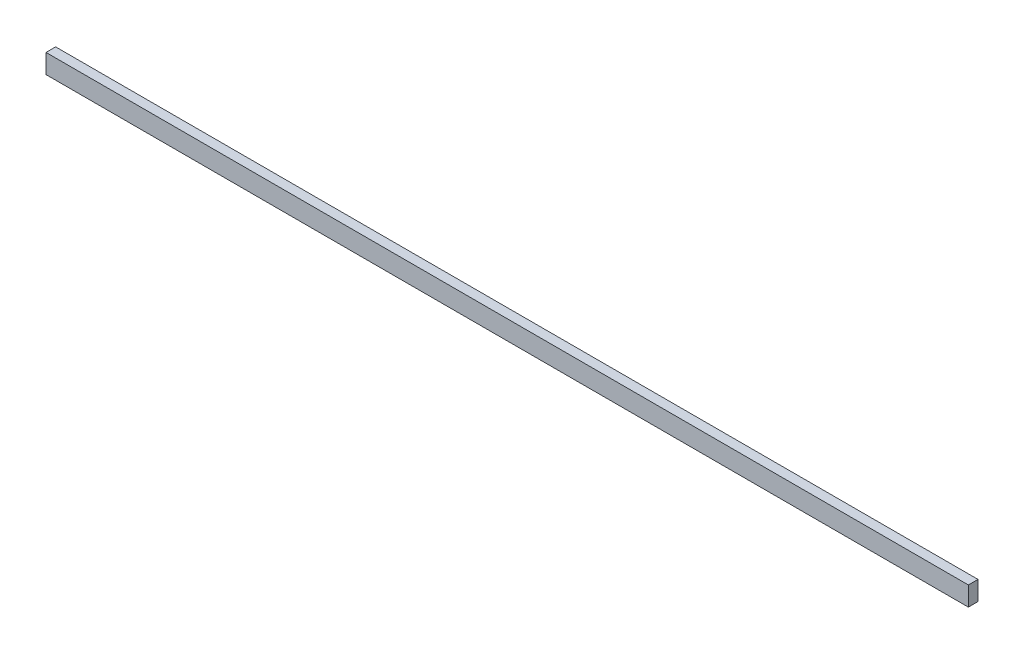
from build123d import *

# Parameters (mm, degrees)
SKETCH2_W           = 457.2
SKETCH2_H           = 4.7752
BOSS_EXTRUDE1_DEPTH = 9.525


with BuildPart() as part:
    # Sketch2 → Boss-Extrude1 (new body)
    with BuildSketch(Plane(origin=(0, 0, 0), x_dir=(1, 0, 0), z_dir=(0, 1, 0))):
        Rectangle(SKETCH2_W, SKETCH2_H)
    extrude(amount=BOSS_EXTRUDE1_DEPTH)


solid = part.part
